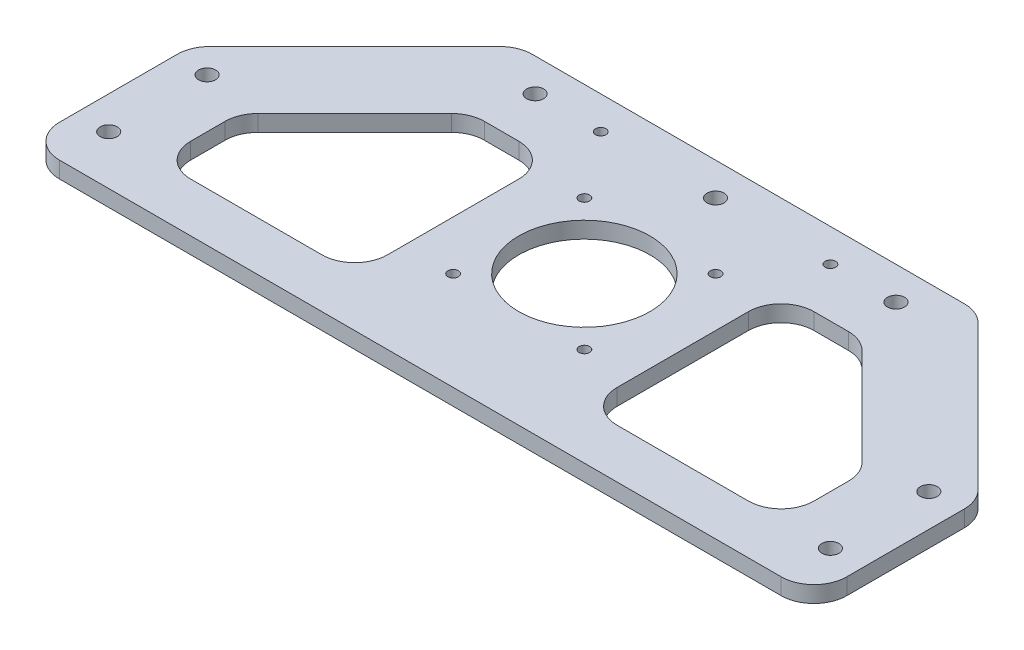
from build123d import *

# Parameters (mm, degrees)
SKETCH_1_R          = 20
SKETCH_1_R_2        = 2.6
EXTRUDE_1_DEPTH     = 5
CUT_EXTRUDE_2_DEPTH = 5
FILLET_1_R          = 10
SKETCH_3_R          = 1.6
CUT_EXTRUDE_3_DEPTH = 131.096118313
SKETCH_4_R          = 1.6
CUT_EXTRUDE_4_DEPTH = 131.096118313


with BuildPart() as part:
    # ｽｹｯﾁ1 → ﾎﾞｽ - 押し出し1 (new body)
    with BuildSketch(Plane(origin=(0, 0, 0), x_dir=(1, 0, 0), z_dir=(0, 1, 0))):
        Polygon((-120, -50), (-120, 0), (-70, 50), (70, 50), (120, 0), (120, -50), align=None)
        with Locations(Location((0, 0, 0), (0, 0, 270))):
            Circle(SKETCH_1_R, mode=Mode.SUBTRACT)
        with Locations(Location((-110, -35, 0), (0, 0, 270))):
            Circle(SKETCH_1_R_2, mode=Mode.SUBTRACT)
        with Locations(Location((-110, -5, 0), (0, 0, 270))):
            Circle(SKETCH_1_R_2, mode=Mode.SUBTRACT)
        with Locations(Location((-55, 40, 0), (0, 0, 270))):
            Circle(SKETCH_1_R_2, mode=Mode.SUBTRACT)
        with Locations(Location((0, 40, 0), (0, 0, 270))):
            Circle(SKETCH_1_R_2, mode=Mode.SUBTRACT)
        with Locations(Location((110, -35, 0), (0, 0, 90))):
            Circle(SKETCH_1_R_2, mode=Mode.SUBTRACT)
        with Locations(Location((110, -5, 0), (0, 0, 90))):
            Circle(SKETCH_1_R_2, mode=Mode.SUBTRACT)
        with Locations(Location((55, 40, 0), (0, 0, 90))):
            Circle(SKETCH_1_R_2, mode=Mode.SUBTRACT)
    extrude(amount=EXTRUDE_1_DEPTH)

    # ｽｹｯﾁ2 → ｶｯﾄ - 押し出し2 (cut)
    with BuildSketch(Plane(origin=(0, 5, 0), x_dir=(1, 0, 0), z_dir=(0, 1, 0))):
        with BuildLine():
            Line((-62.573593129, 22.071067812), (-92.071067812, -7.426406871))
            ThreePointArc((-92.071067812, -7.426406871), (-94.238795325, -10.670640359), (-95, -14.497474683))
            Line((-95, -14.497474683), (-95, -25))
            ThreePointArc((-95, -25), (-92.071067812, -32.071067812), (-85, -35))
            Line((-85, -35), (-45, -35))
            ThreePointArc((-45, -35), (-37.928932188, -32.071067812), (-35, -25))
            Line((-35, -25), (-35, 15))
            ThreePointArc((-35, 15), (-37.928932188, 22.071067812), (-45, 25))
            Line((-45, 25), (-55.502525317, 25))
            ThreePointArc((-55.502525317, 25), (-59.329359641, 24.238795325), (-62.573593129, 22.071067812))
        make_face()
        with BuildLine():
            Line((35, -25), (35, 15))
            ThreePointArc((35, 15), (37.928932188, 22.071067812), (45, 25))
            Line((45, 25), (55.502525317, 25))
            ThreePointArc((55.502525317, 25), (59.329359641, 24.238795325), (62.573593129, 22.071067812))
            Line((62.573593129, 22.071067812), (92.071067812, -7.426406871))
            ThreePointArc((92.071067812, -7.426406871), (94.238795325, -10.670640359), (95, -14.497474683))
            Line((95, -14.497474683), (95, -25))
            ThreePointArc((95, -25), (92.071067812, -32.071067812), (85, -35))
            Line((85, -35), (45, -35))
            ThreePointArc((45, -35), (37.928932188, -32.071067812), (35, -25))
        make_face()
    extrude(amount=-CUT_EXTRUDE_2_DEPTH, mode=Mode.SUBTRACT)

    # ﾌｨﾚｯﾄ1
    fillet_1_edges = [part.edges().sort_by_distance(p)[0] for p in [
        (-120, 2.5, 50),
        (-120, 2.5, 0),
        (-70, 2.5, -50),
        (70, 2.5, -50),
        (120, 2.5, 0),
        (120, 2.5, 50),
    ]]
    fillet(fillet_1_edges, radius=FILLET_1_R)

    # ｽｹｯﾁ3 → ｶｯﾄ - 押し出し3 (cut, through all)
    with BuildSketch(Plane(origin=(0, 5, 0), x_dir=(1, 0, 0), z_dir=(0, 1, 0))):
        with Locations(Location((-20, 20, 0), (0, 0, 270))):
            Circle(SKETCH_3_R)
        with Locations(Location((20, 20, 0), (0, 0, 270))):
            Circle(SKETCH_3_R)
        with Locations(Location((20, -20, 0), (0, 0, 270))):
            Circle(SKETCH_3_R)
        with Locations(Location((-20, -20, 0), (0, 0, 270))):
            Circle(SKETCH_3_R)
    extrude(amount=-CUT_EXTRUDE_3_DEPTH, mode=Mode.SUBTRACT)

    # ｽｹｯﾁ4 → ｶｯﾄ - 押し出し4 (cut, through all)
    with BuildSketch(Plane(origin=(0, 5, 0), x_dir=(1, 0, 0), z_dir=(0, 1, 0))):
        with Locations(Location((-35, 40, 0), (0, 0, 270))):
            Circle(SKETCH_4_R)
        with Locations(Location((35, 40, 0), (0, 0, 90))):
            Circle(SKETCH_4_R)
    extrude(amount=-CUT_EXTRUDE_4_DEPTH, mode=Mode.SUBTRACT)


solid = part.part
